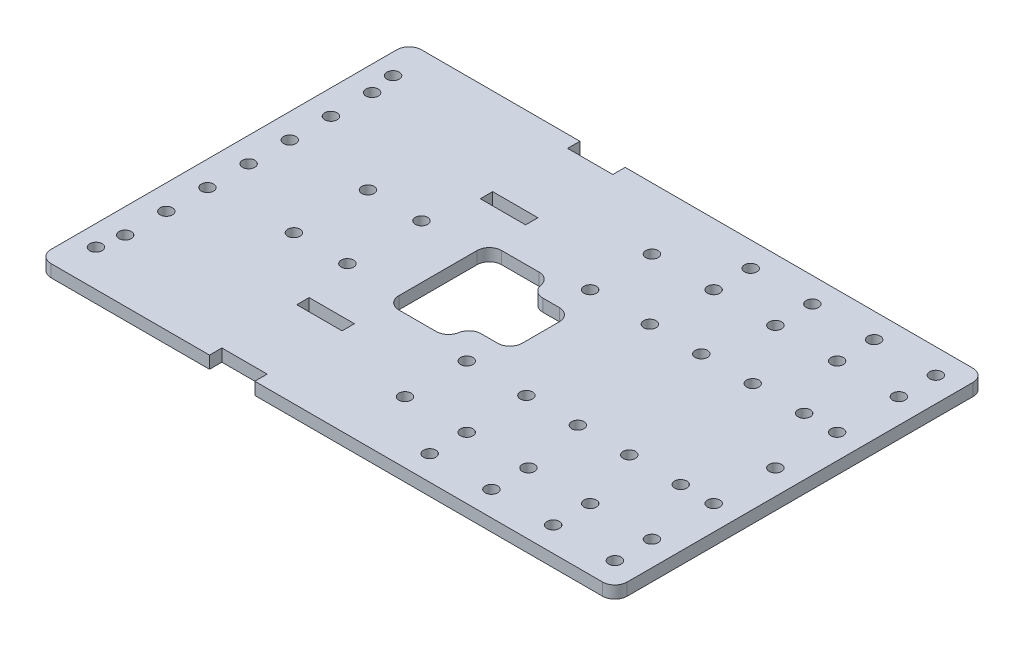
from build123d import *

# Parameters (mm, degrees)
SKETCH1_W           = 140
SKETCH1_H           = 90
PLAIN_BOARD_DEPTH   = 3
SKETCH2_W           = 11
SKETCH2_H           = 3
MOTOR_MOUNT_DEPTH   = 3
SKETCH3_R           = 1.5
CASTER_DEPTH        = 3
SKETCH4_R           = 1.5
PCBS_DEPTH          = 3
SKETCH5_W           = 10
SKETCH5_H           = 15
SKETCH5_W_2         = 15
SKETCH5_H_2         = 25
CABLE_HOLE_DEPTH    = 3
SKETCH6_R           = 1.5
SERVO_BOARD_DEPTH   = 3
SKETCH7_R           = 1.5
SENSOR_HOLES_DEPTH  = 3
SKETCH8_R           = 1.5
SERVO_BOARD_2_DEPTH = 3
FILLET1_R           = 3
FILLET3_R           = 3


with BuildPart() as part:
    # Sketch1 → Plain Board (new body)
    with BuildSketch(Plane(origin=(0, 0, 0), x_dir=(1, 0, 0), z_dir=(0, 1, 0))):
        with Locations((70, 45)):
            Rectangle(SKETCH1_W, SKETCH1_H)
    extrude(amount=PLAIN_BOARD_DEPTH)

    # Sketch2 → Motor Mount (cut)
    with BuildSketch(Plane(origin=(0, 3, 0), x_dir=(1, 0, 0), z_dir=(0, 1, 0))):
        with Locations((47, 1.5)):
            Rectangle(SKETCH2_W, SKETCH2_H)
        with Locations((47, 22.7)):
            Rectangle(SKETCH2_W, SKETCH2_H)
        with Locations((47, 67.3)):
            Rectangle(SKETCH2_W, SKETCH2_H)
        with Locations((47, 88.5)):
            Rectangle(SKETCH2_W, SKETCH2_H)
    extrude(amount=-MOTOR_MOUNT_DEPTH, mode=Mode.SUBTRACT)

    # Sketch3 → Caster (cut)
    with BuildSketch(Plane(origin=(0, 3, 0), x_dir=(1, 0, 0), z_dir=(0, 1, 0))):
        with Locations(Location((126, 60, 0), (0, 0, 270))):
            Circle(SKETCH3_R)
        with Locations(Location((113.5, 60, 0), (0, 0, 270))):
            Circle(SKETCH3_R)
        with Locations(Location((101, 60, 0), (0, 0, 270))):
            Circle(SKETCH3_R)
        with Locations(Location((88.5, 60, 0), (0, 0, 270))):
            Circle(SKETCH3_R)
        with Locations(Location((113.5, 30, 0), (0, 0, 270))):
            Circle(SKETCH3_R)
        with Locations(Location((101, 30, 0), (0, 0, 270))):
            Circle(SKETCH3_R)
        with Locations(Location((88.5, 30, 0), (0, 0, 270))):
            Circle(SKETCH3_R)
        with Locations(Location((126, 30, 0), (0, 0, 270))):
            Circle(SKETCH3_R)
    extrude(amount=-CASTER_DEPTH, mode=Mode.SUBTRACT)

    # Sketch4 → PCBs (cut)
    with BuildSketch(Plane(origin=(0, 3, 0), x_dir=(1, 0, 0), z_dir=(0, 1, 0))):
        with Locations(Location((5, 8.9, 0), (0, 0, 270))):
            Circle(SKETCH4_R)
        with Locations(Location((26, 36, 0), (0, 0, 270))):
            Circle(SKETCH4_R)
        with Locations(Location((39, 36, 0), (0, 0, 270))):
            Circle(SKETCH4_R)
        with Locations(Location((5, 81.1, 0), (0, 0, 90))):
            Circle(SKETCH4_R)
        with Locations(Location((39, 54, 0), (0, 0, 90))):
            Circle(SKETCH4_R)
        with Locations(Location((26, 54, 0), (0, 0, 90))):
            Circle(SKETCH4_R)
    extrude(amount=-PCBS_DEPTH, mode=Mode.SUBTRACT)

    # Sketch5 → Cable Hole (cut)
    with BuildSketch(Plane(origin=(0, 3, 0), x_dir=(1, 0, 0), z_dir=(0, 1, 0))):
        with Locations((72, 45)):
            Rectangle(SKETCH5_W, SKETCH5_H)
        with Locations((59.5, 45)):
            Rectangle(SKETCH5_W_2, SKETCH5_H_2)
    extrude(amount=-CABLE_HOLE_DEPTH, mode=Mode.SUBTRACT)

    # Sketch6 → Servo Board (cut)
    with BuildSketch(Plane(origin=(0, 3, 0), x_dir=(1, 0, 0), z_dir=(0, 1, 0))):
        with Locations(Location((134, 15, 0), (0, 0, 270))):
            Circle(SKETCH6_R)
        with Locations(Location((119, 15, 0), (0, 0, 270))):
            Circle(SKETCH6_R)
        with Locations(Location((104, 15, 0), (0, 0, 270))):
            Circle(SKETCH6_R)
        with Locations(Location((89, 15, 0), (0, 0, 270))):
            Circle(SKETCH6_R)
        with Locations(Location((119, 75, 0), (0, 0, 270))):
            Circle(SKETCH6_R)
        with Locations(Location((104, 75, 0), (0, 0, 270))):
            Circle(SKETCH6_R)
        with Locations(Location((89, 75, 0), (0, 0, 270))):
            Circle(SKETCH6_R)
        with Locations(Location((134, 75, 0), (0, 0, 270))):
            Circle(SKETCH6_R)
    extrude(amount=-SERVO_BOARD_DEPTH, mode=Mode.SUBTRACT)

    # Sketch7 → Sensor Holes (cut)
    with BuildSketch(Plane(origin=(0, 3, 0), x_dir=(1, 0, 0), z_dir=(0, 1, 0))):
        with Locations(Location((134, 45, 0), (0, 0, 270))):
            Circle(SKETCH7_R)
        with Locations(Location((134, 6, 0), (0, 0, 270))):
            Circle(SKETCH7_R)
        with Locations(Location((119, 6, 0), (0, 0, 270))):
            Circle(SKETCH7_R)
        with Locations(Location((104, 6, 0), (0, 0, 270))):
            Circle(SKETCH7_R)
        with Locations(Location((89, 6, 0), (0, 0, 270))):
            Circle(SKETCH7_R)
        with Locations(Location((134, 60, 0), (0, 0, 270))):
            Circle(SKETCH7_R)
        with Locations(Location((134, 30, 0), (0, 0, 90))):
            Circle(SKETCH7_R)
        with Locations(Location((6, 45, 0), (0, 0, 270))):
            Circle(SKETCH7_R)
        with Locations(Location((6, 35, 0), (0, 0, 270))):
            Circle(SKETCH7_R)
        with Locations(Location((6, 25, 0), (0, 0, 270))):
            Circle(SKETCH7_R)
        with Locations(Location((6, 15, 0), (0, 0, 270))):
            Circle(SKETCH7_R)
        with Locations(Location((89, 84, 0), (0, 0, 90))):
            Circle(SKETCH7_R)
        with Locations(Location((104, 84, 0), (0, 0, 90))):
            Circle(SKETCH7_R)
        with Locations(Location((119, 84, 0), (0, 0, 90))):
            Circle(SKETCH7_R)
        with Locations(Location((134, 84, 0), (0, 0, 90))):
            Circle(SKETCH7_R)
        with Locations(Location((6, 75, 0), (0, 0, 90))):
            Circle(SKETCH7_R)
        with Locations(Location((6, 65, 0), (0, 0, 90))):
            Circle(SKETCH7_R)
        with Locations(Location((6, 55, 0), (0, 0, 90))):
            Circle(SKETCH7_R)
    extrude(amount=-SENSOR_HOLES_DEPTH, mode=Mode.SUBTRACT)

    # Sketch8 → Servo Board(2) (cut)
    with BuildSketch(Plane(origin=(0, 3, 0), x_dir=(1, 0, 0), z_dir=(0, 1, 0))):
        with Locations(Location((74, 60, 0), (0, 0, 270))):
            Circle(SKETCH8_R)
        with Locations(Location((74, 75, 0), (0, 0, 270))):
            Circle(SKETCH8_R)
        with Locations(Location((74, 15, 0), (0, 0, 90))):
            Circle(SKETCH8_R)
        with Locations(Location((74, 30, 0), (0, 0, 90))):
            Circle(SKETCH8_R)
    extrude(amount=-SERVO_BOARD_2_DEPTH, mode=Mode.SUBTRACT)

    # Fillet1
    fillet1_edges = [part.edges().sort_by_distance(p)[0] for p in [
        (77, 1.5, -52.5),
        (77, 1.5, -37.5),
        (67, 1.5, -37.5),
        (52, 1.5, -32.5),
        (52, 1.5, -57.5),
        (67, 1.5, -52.5),
        (0, 1.5, -90),
    ]]
    fillet(fillet1_edges, radius=FILLET1_R)

    # Fillet3
    fillet3_edges = [part.edges().sort_by_distance(p)[0] for p in [
        (140, 1.5, -90),
        (140, 1.5, 0),
        (0, 1.5, 0),
        (67, 1.5, -57.5),
        (67, 1.5, -32.5),
    ]]
    fillet(fillet3_edges, radius=FILLET3_R)


solid = part.part
